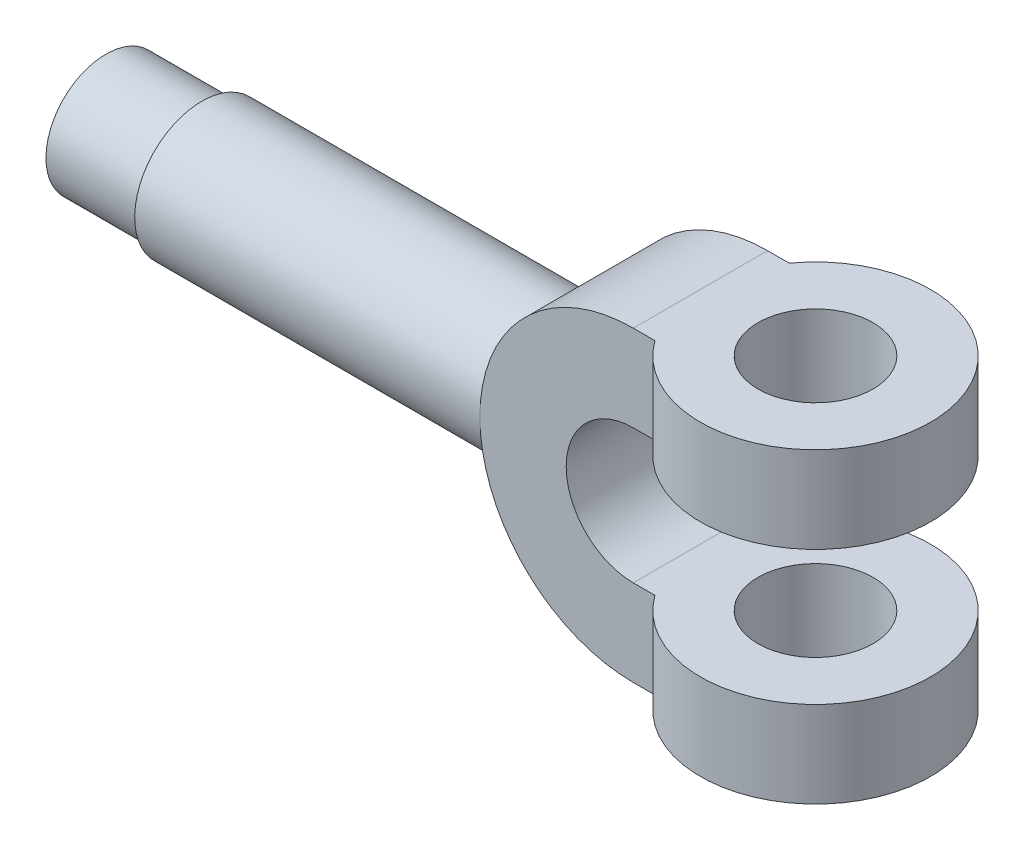
from build123d import *

# Parameters (mm, degrees)
SKETCH2_R           = 24
SKETCH2_R_2         = 12
BOSS_EXTRUDE2_DEPTH = 18
SKETCH3_R           = 24
SKETCH3_R_2         = 12
BOSS_EXTRUDE3_DEPTH = 18
BOSS_EXTRUDE4_DEPTH = 14
SKETCH6_R           = 12.5
BOSS_EXTRUDE5_DEPTH = 20
BOSS_EXTRUDE7_START = -18
BOSS_EXTRUDE7_DEPTH = 18
BOSS_EXTRUDE8_DEPTH = 18


with BuildPart() as part:
    # Sketch2 → Boss-Extrude2 (new body)
    with BuildSketch(Plane(origin=(0, 0, 0), x_dir=(1, 0, 0), z_dir=(0, 1, 0))):
        with Locations(Location((0, 0, 0), (0, 0, 270))):
            Circle(SKETCH2_R)
        with Locations(Location((0, 0, 0), (0, 0, 270))):
            Circle(SKETCH2_R_2, mode=Mode.SUBTRACT)
    extrude(amount=BOSS_EXTRUDE2_DEPTH)



with BuildPart() as body_2:
    # Sketch3 → Boss-Extrude3 (new body)
    with BuildSketch(Plane(origin=(0, 46, 0), x_dir=(1, 0, 0), z_dir=(0, 1, 0))):
        with Locations(Location((0, 0, 0), (0, 0, 270))):
            Circle(SKETCH3_R)
        with Locations(Location((0, 0, 0), (0, 0, 270))):
            Circle(SKETCH3_R_2, mode=Mode.SUBTRACT)
    extrude(amount=BOSS_EXTRUDE3_DEPTH)



with BuildPart() as body_3:
    # Sketch4 → Boss-Extrude4 (new, symmetric)
    with BuildSketch(Plane.XY):
        with BuildLine():
            Line((-24, 64), (-24, 46))
            ThreePointArc((-24, 46), (-38, 32), (-24, 18))
            Line((-24, 18), (-24, 0))
            ThreePointArc((-24, 0), (-56, 32), (-24, 64))
        make_face()
    extrude(amount=BOSS_EXTRUDE4_DEPTH, both=True)

    # Sketch5 → Revolve1 (revolve)
    with BuildSketch(Plane.XY, mode=Mode.PRIVATE) as revolve1_sk:
        with BuildLine():
            Line((-52.77498914, 46), (-128, 46))
            Line((-128, 46), (-128, 32))
            Line((-128, 32), (-56, 32))
            ThreePointArc((-56, 32), (-55.183326093, 39.183326093), (-52.77498914, 46))
        make_face()
    revolve(revolve1_sk.sketch.rotate(Axis((-128, 32, 0), (1, 0, 0)), 180), axis=Axis((-128, 32, 0), (1, 0, 0)))

    # Sketch6 → Boss-Extrude5 (add)
    with BuildSketch(Plane.ZY.offset(128)):
        with Locations(Location((0, 32, 0), (0, 0, 270))):
            Circle(SKETCH6_R)
    extrude(amount=BOSS_EXTRUDE5_DEPTH)


with BuildPart() as body_2_1:
    add(body_2.part)

    add(body_3.part)  # Boss-Extrude7 merges body 3
    # Sketch7 → Boss-Extrude7 (add)
    with BuildSketch(Plane(origin=(0, 64, 0), x_dir=(1, 0, 0), z_dir=(0, 1, 0)).offset(BOSS_EXTRUDE7_START)):
        with BuildLine():
            Line((-24, 14), (-19.49358869, 14))
            ThreePointArc((-19.49358869, 14), (-22.845635563, 7.353702178), (-24, 0))
            Line((-24, 0), (-24, 14))
        make_face()
    boss_extrude7 = extrude(amount=BOSS_EXTRUDE7_DEPTH)

    # Mirror1: Boss-Extrude7 across plane
    add(boss_extrude7.mirror(Plane.XY))


with BuildPart() as part_1:
    add(part.part)

    add(body_2_1.part)  # Boss-Extrude8 merges body 2
    # Sketch8 → Boss-Extrude8 (add)
    with BuildSketch(Plane.XZ):
        with BuildLine():
            Line((-24, 14), (-19.49358869, 14))
            ThreePointArc((-19.49358869, 14), (-22.845635563, 7.353702178), (-24, 0))
            Line((-24, 0), (-24, 14))
        make_face()
    boss_extrude8 = extrude(amount=-BOSS_EXTRUDE8_DEPTH)

    # Mirror2: Boss-Extrude8 across plane
    add(boss_extrude8.mirror(Plane.XY))


solid = part_1.part
